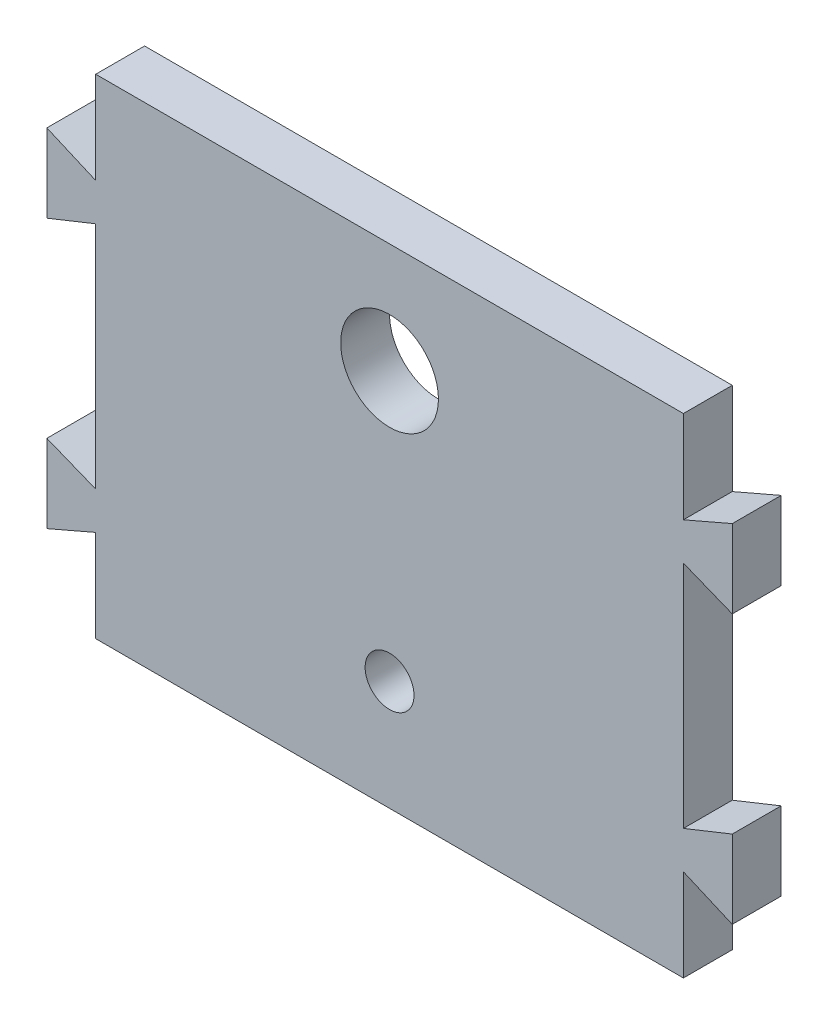
from build123d import *

# Parameters (mm, degrees)
SKETCH1_W           = 38.170316933
SKETCH1_H           = 31.751666379
BOSS_EXTRUDE1_DEPTH = 3.175
SKETCH2_R           = 3.175
SKETCH2_R_2         = 1.5875
CUT_EXTRUDE1_DEPTH  = 3.175


with BuildPart() as part:
    # Sketch1 → Boss-Extrude1 (new body)
    with BuildSketch(Plane.XY):
        with Locations((19.085158467, 15.87583319)):
            Rectangle(SKETCH1_W, SKETCH1_H)
        Polygon((-3.175, 24.607083189), (-3.175, 27.147083189), (0, 25.774124793), (0, 23.337083189), (-3.175, 22.067083189), align=None)
        Polygon((-3.175, 7.144583189), (-3.175, 9.684583189), (0, 8.414583189), (0, 5.977541585), (-3.175, 4.604583189), align=None)
        Polygon((41.345316933, 7.144583189), (41.345316933, 4.604583189), (38.170316933, 5.977541585), (38.170316933, 8.414583189), (41.345316933, 9.684583189), align=None)
        Polygon((41.345316933, 24.607083189), (41.345316933, 22.067083189), (38.170316933, 23.337083189), (38.170316933, 25.774124793), (41.345316933, 27.147083189), align=None)
    extrude(amount=BOSS_EXTRUDE1_DEPTH)

    # Sketch2 → Cut-Extrude1 (cut)
    with BuildSketch(Plane.XY.offset(3.175)):
        with Locations((19.085158466, 24.607083189)):
            Circle(SKETCH2_R)
        with Locations((19.085158466, 7.144583189)):
            Circle(SKETCH2_R_2)
    extrude(amount=-CUT_EXTRUDE1_DEPTH, mode=Mode.SUBTRACT)


solid = part.part
